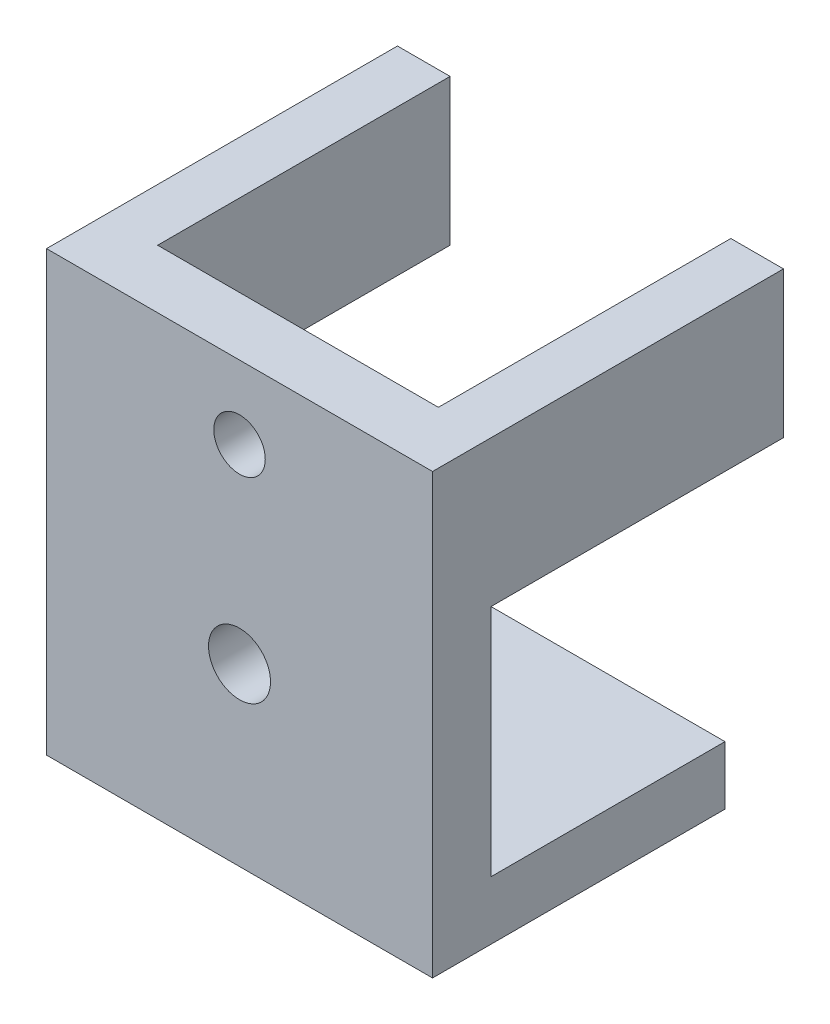
from build123d import *

# Parameters (mm, degrees)
SKETCH2_W           = 33
SKETCH2_H           = 37.5
BOSS_EXTRUDE1_DEPTH = 5
SKETCH3_W           = 33
SKETCH3_H           = 5
BOSS_EXTRUDE2_DEPTH = 20
SKETCH6_R           = 2.65
CUT_EXTRUDE2_DEPTH  = 10
SKETCH7_R           = 2.65
CUT_EXTRUDE3_DEPTH  = 10
SKETCH8_W           = 4.5
SKETCH8_H           = 12.5
BOSS_EXTRUDE3_DEPTH = 25
SKETCH9_R           = 2.2
CUT_EXTRUDE4_DEPTH  = 10


with BuildPart() as part:
    # Sketch2 → Boss-Extrude1 (new body)
    with BuildSketch(Plane.XY):
        with Locations((16.5, 18.75)):
            Rectangle(SKETCH2_W, SKETCH2_H)
    extrude(amount=BOSS_EXTRUDE1_DEPTH)

    # Sketch3 → Boss-Extrude2 (add)
    with BuildSketch(Plane.XY):
        with Locations((16.5, 2.5)):
            Rectangle(SKETCH3_W, SKETCH3_H)
    extrude(amount=-BOSS_EXTRUDE2_DEPTH)

    # Sketch6 → Cut-Extrude2 (cut)
    with BuildSketch(Plane.XZ):
        with Locations(Location((16.5, -10, 0), (0, 0, 270))):
            Circle(SKETCH6_R)
    extrude(amount=-CUT_EXTRUDE2_DEPTH, mode=Mode.SUBTRACT)

    # Sketch7 → Cut-Extrude3 (cut)
    with BuildSketch(Plane(origin=(0, 0, 0), x_dir=(-1, 0, 0), z_dir=(0, 0, -1))):
        with Locations((-16.5, 15)):
            Circle(SKETCH7_R)
    extrude(amount=-CUT_EXTRUDE3_DEPTH, mode=Mode.SUBTRACT)

    # Sketch8 → Boss-Extrude3 (add)
    with BuildSketch(Plane(origin=(0, 0, 0), x_dir=(-1, 0, 0), z_dir=(0, 0, -1))):
        with Locations((-30.75, 31.25)):
            Rectangle(SKETCH8_W, SKETCH8_H)
        with Locations((-2.25, 31.25)):
            Rectangle(SKETCH8_W, SKETCH8_H)
    extrude(amount=BOSS_EXTRUDE3_DEPTH)

    # Sketch9 → Cut-Extrude4 (cut)
    with BuildSketch(Plane.XY.offset(5)):
        with Locations((16.5, 31.25)):
            Circle(SKETCH9_R)
    extrude(amount=-CUT_EXTRUDE4_DEPTH, mode=Mode.SUBTRACT)


solid = part.part
